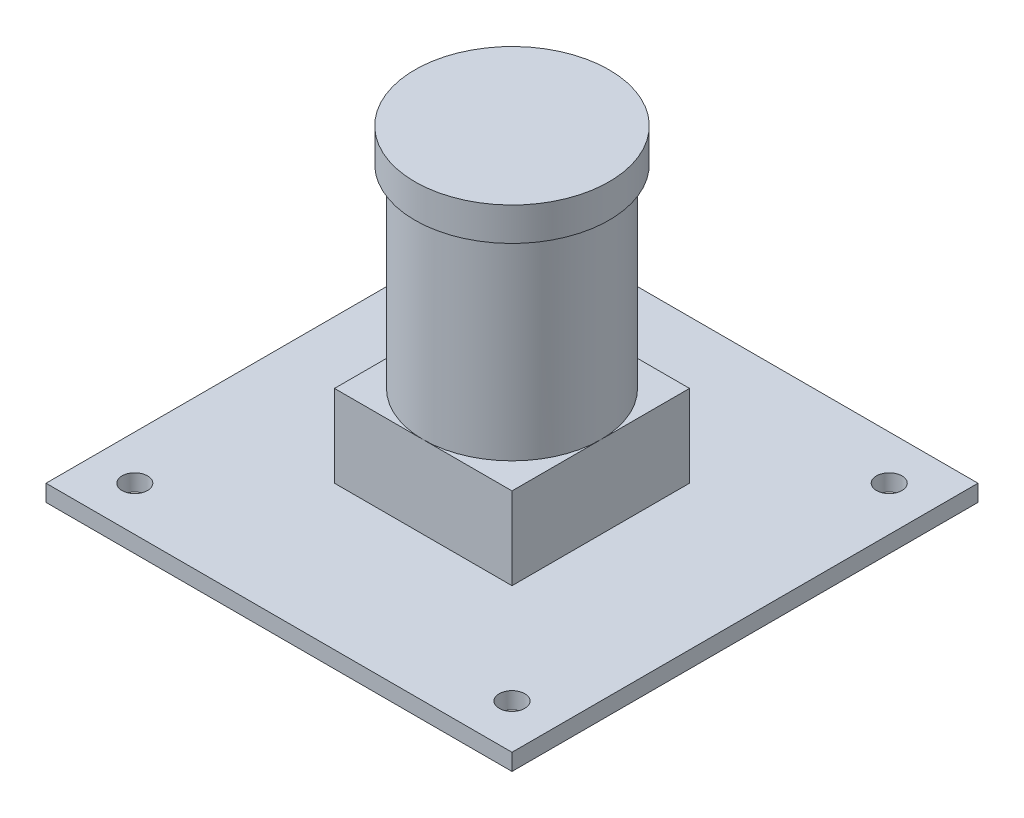
from build123d import *

# Parameters (mm, degrees)
SKETCH_1_W          = 42
SKETCH_1_H          = 42
EXTRUDE_1_DEPTH     = 1.5
SKETCH_2_R          = 1.15
CUT_EXTRUDE_1_DEPTH = 2
SKETCH_3_R          = 8
EXTRUDE_2_DEPTH     = 24.9
SKETCH_4_W          = 16
SKETCH_4_H          = 16
EXTRUDE_3_DEPTH     = 7.4
SKETCH_5_R          = 8.75
EXTRUDE_4_DEPTH     = 3


with BuildPart() as part:
    # 草图1 → 凸台-拉伸1 (new body)
    with BuildSketch(Plane(origin=(0, 0, 0), x_dir=(1, 0, 0), z_dir=(0, 1, 0))):
        Rectangle(SKETCH_1_W, SKETCH_1_H)
    extrude(amount=EXTRUDE_1_DEPTH)

    # 草图2 → 切除-拉伸1 (cut)
    with BuildSketch(Plane(origin=(0, 1.5, 0), x_dir=(1, 0, 0), z_dir=(0, 1, 0))):
        with Locations(Location((-17, 17, 0), (0, 0, 270))):
            Circle(SKETCH_2_R)
        with Locations(Location((17, 17, 0), (0, 0, 270))):
            Circle(SKETCH_2_R)
        with Locations(Location((-17, -17, 0), (0, 0, 270))):
            Circle(SKETCH_2_R)
        with Locations(Location((17, -17, 0), (0, 0, 270))):
            Circle(SKETCH_2_R)
    extrude(amount=-CUT_EXTRUDE_1_DEPTH, mode=Mode.SUBTRACT)

    # 草图3 → 凸台-拉伸2 (add)
    with BuildSketch(Plane(origin=(0, 1.5, 0), x_dir=(1, 0, 0), z_dir=(0, 1, 0))):
        with Locations(Location((0, 0, 0), (0, 0, 270))):
            Circle(SKETCH_3_R)
    extrude(amount=EXTRUDE_2_DEPTH)

    # 草图4 → 凸台-拉伸3 (add)
    with BuildSketch(Plane(origin=(0, 1.5, 0), x_dir=(1, 0, 0), z_dir=(0, 1, 0))):
        Rectangle(SKETCH_4_W, SKETCH_4_H)
    extrude(amount=EXTRUDE_3_DEPTH)

    # 草图5 → 凸台-拉伸4 (add)
    with BuildSketch(Plane(origin=(0, 26.4, 0), x_dir=(1, 0, 0), z_dir=(0, 1, 0))):
        with Locations(Location((0, 0, 0), (0, 0, 270))):
            Circle(SKETCH_5_R)
    extrude(amount=EXTRUDE_4_DEPTH)


solid = part.part
